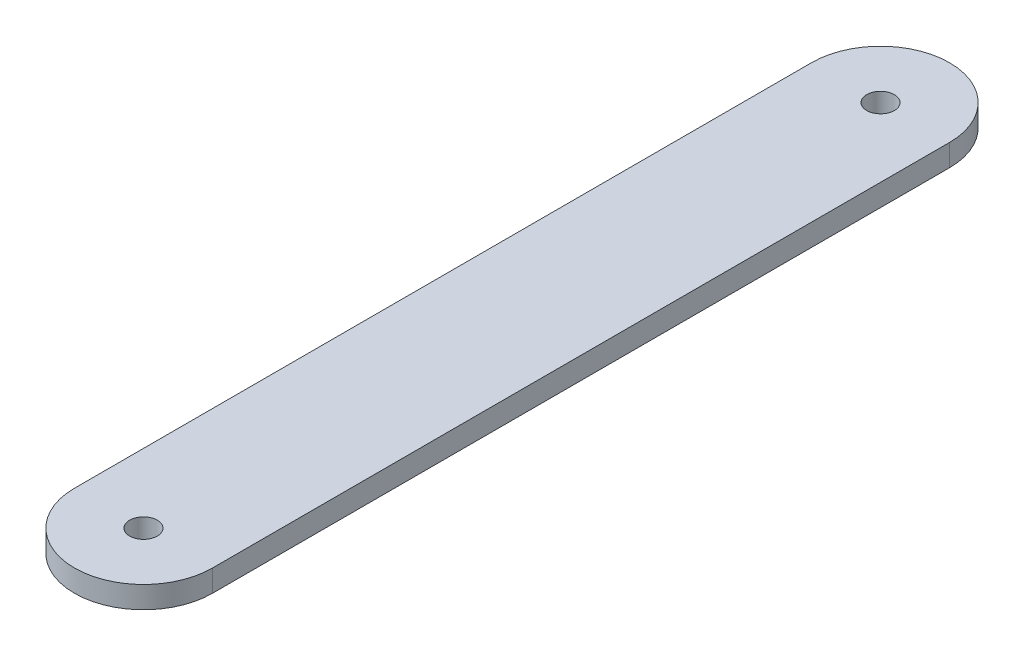
from build123d import *

# Parameters (mm, degrees)
SKETCH2_R           = 1
BOSS_EXTRUDE1_DEPTH = 1.5875


with BuildPart() as part:
    # Sketch2 → Boss-Extrude1 (new body)
    with BuildSketch(Plane(origin=(0, 0, 0), x_dir=(1, 0, 0), z_dir=(0, 1, 0))):
        with BuildLine():
            Line((-5, 53.3739), (-5, 0))
            ThreePointArc((-5, 0), (0, -5), (5, 0))
            Line((5, 0), (5, 53.3739))
            ThreePointArc((5, 53.3739), (0, 58.3739), (-5, 53.3739))
        make_face()
        with Locations(Location((0, 0, 0), (0, 0, 270))):
            Circle(SKETCH2_R, mode=Mode.SUBTRACT)
        with Locations(Location((0, 53.3739, 0), (0, 0, 270))):
            Circle(SKETCH2_R, mode=Mode.SUBTRACT)
    extrude(amount=BOSS_EXTRUDE1_DEPTH)


solid = part.part
